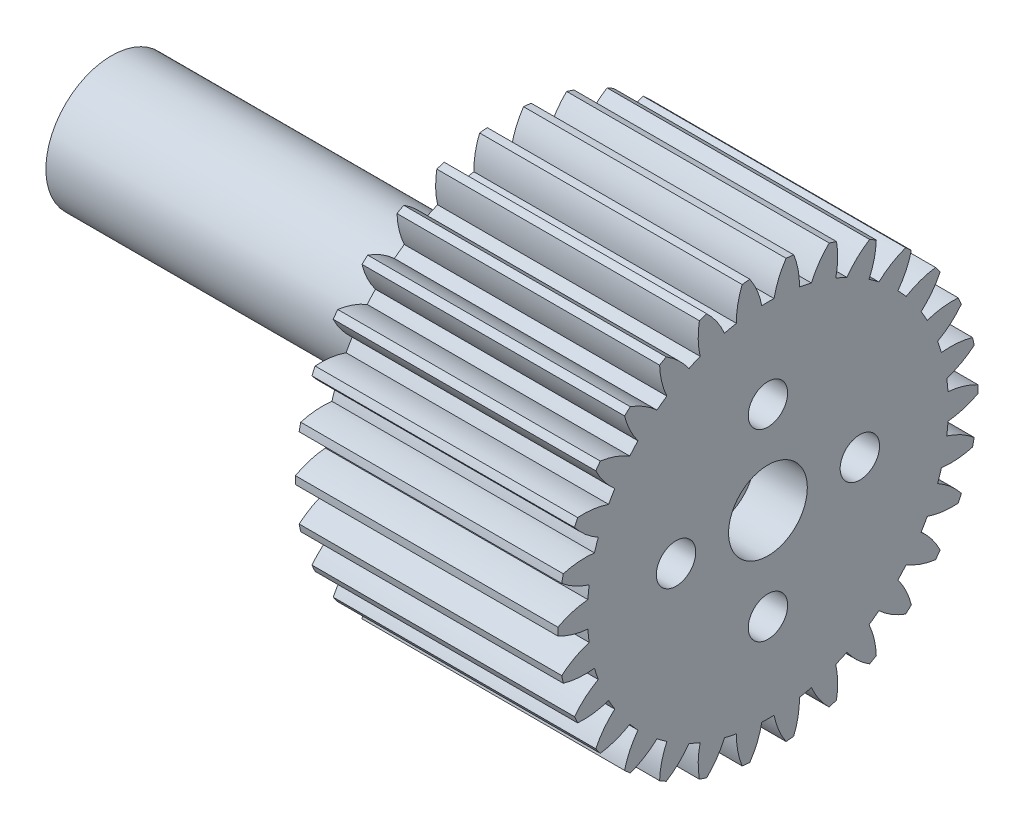
from build123d import *

# Parameters (mm, degrees)
BASPROSKE_W            = 20
BASPROSKE_H            = 16
TOOTHCUT_DEPTH         = 31.199337741
TEETHCUTS_COUNT        = 30
TEETHCUTS_ANGLE        = 348
BORSKE_R               = 0.4
BORE_DEPTH             = 50.0000508
SKETCH_2_R             = 5
EXTRUDE_1_DEPTH        = 50
CUT_EXTRUDE_1_REACH    = 56.864
SKETCH_3_R             = 1.5
CUT_EXTRUDE_2_DEPTH    = 4
HOLE_WIZARD_M6_1_D     = 5
HOLE_WIZARD_M6_1_DEPTH = 15
HOLE_WIZARD_M6_1_TIP   = 1.502151548


with BuildPart() as part:
    # BasProSke → Base-Revolve (revolve)
    with BuildSketch(Plane(origin=(0, 0, 0), x_dir=(1, 0, 0), z_dir=(0, 1, 0)), mode=Mode.PRIVATE) as base_revolve_sk:
        with Locations((10, 8)):
            Rectangle(BASPROSKE_W, BASPROSKE_H)
    revolve(base_revolve_sk.sketch.rotate(Axis((-10, 0, 0), (1, 0, 0)), 180), axis=Axis((-10, 0, 0), (1, 0, 0)))

    # TooCutSke → ToothCut (cut, through all)
    with BuildSketch(Plane(origin=(0, 0, 0), x_dir=(0, 0, -1), z_dir=(1, 0, 0))):
        with BuildLine():
            ThreePointArc((0.466400716, 13.741086979), (0, 13.749), (-0.466400716, 13.741086979))
            ThreePointArc((-0.466400716, 13.741086979), (-0.819142092, 14.899954875), (-1.3974676, 15.964351834))
            ThreePointArc((-1.3974676, 15.964351834), (0, 16.0254), (1.3974676, 15.964351834))
            ThreePointArc((1.3974676, 15.964351834), (0.819142092, 14.899954875), (0.466400716, 13.741086979))
        make_face()
    toothcut = extrude(amount=TOOTHCUT_DEPTH, mode=Mode.SUBTRACT)

    # TeethCuts: ToothCut ×30 about axis
    teethcuts_axis = Axis((-10, 0, 0), (1, 0, 0))
    for i in range(1, TEETHCUTS_COUNT):
        add(toothcut.rotate(teethcuts_axis, i * TEETHCUTS_ANGLE / (TEETHCUTS_COUNT - 1)), mode=Mode.SUBTRACT)

    # BorSke → Bore (cut, symmetric)
    with BuildSketch(Plane(origin=(0, 0, 0), x_dir=(0, 0, -1), z_dir=(1, 0, 0))):
        with Locations(Location((0, 0, 0), (0, 0, 180))):
            Circle(BORSKE_R)
    extrude(amount=BORE_DEPTH, both=True, mode=Mode.SUBTRACT)

    # 草图2 → 凸台-拉伸1 (add)
    with BuildSketch(Plane(origin=(20, 0, 0), x_dir=(0, 0, -1), z_dir=(1, 0, 0))):
        Circle(SKETCH_2_R)
    extrude(amount=-EXTRUDE_1_DEPTH)

    # 草图3 → 切除-拉伸1 (cut, up to next)
    with BuildSketch(Plane(origin=(20, 0, 0), x_dir=(0, 0, -1), z_dir=(1, 0, 0)), mode=Mode.PRIVATE) as cut_extrude_1_sk1:
        with Locations((0, 7)):
            Circle(SKETCH_3_R)
    cut_extrude_1_tool1 = extrude(cut_extrude_1_sk1.sketch, amount=-CUT_EXTRUDE_1_REACH, mode=Mode.PRIVATE) & part.part
    # 草图3 → 切除-拉伸1 (cut, up to next)
    with BuildSketch(Plane(origin=(20, 0, 0), x_dir=(0, 0, -1), z_dir=(1, 0, 0)), mode=Mode.PRIVATE) as cut_extrude_1_sk2:
        with Locations((7, 0)):
            Circle(SKETCH_3_R)
    cut_extrude_1_tool2 = extrude(cut_extrude_1_sk2.sketch, amount=-CUT_EXTRUDE_1_REACH, mode=Mode.PRIVATE) & part.part
    # 草图3 → 切除-拉伸1 (cut, up to next)
    with BuildSketch(Plane(origin=(20, 0, 0), x_dir=(0, 0, -1), z_dir=(1, 0, 0)), mode=Mode.PRIVATE) as cut_extrude_1_sk3:
        with Locations((0, -7)):
            Circle(SKETCH_3_R)
    cut_extrude_1_tool3 = extrude(cut_extrude_1_sk3.sketch, amount=-CUT_EXTRUDE_1_REACH, mode=Mode.PRIVATE) & part.part
    # 草图3 → 切除-拉伸1 (cut, up to next)
    with BuildSketch(Plane(origin=(20, 0, 0), x_dir=(0, 0, -1), z_dir=(1, 0, 0)), mode=Mode.PRIVATE) as cut_extrude_1_sk4:
        with Locations((-7, 0)):
            Circle(SKETCH_3_R)
    cut_extrude_1_tool4 = extrude(cut_extrude_1_sk4.sketch, amount=-CUT_EXTRUDE_1_REACH, mode=Mode.PRIVATE) & part.part
    add(cut_extrude_1_tool1.solids().sort_by_distance((20, 7, 0))[0], mode=Mode.SUBTRACT)
    add(cut_extrude_1_tool2.solids().sort_by_distance((20, 0, -7))[0], mode=Mode.SUBTRACT)
    add(cut_extrude_1_tool3.solids().sort_by_distance((20, -7, 0))[0], mode=Mode.SUBTRACT)
    add(cut_extrude_1_tool4.solids().sort_by_distance((20, 0, 7))[0], mode=Mode.SUBTRACT)

    # 草图1 → 切除-拉伸2 (cut)
    with BuildSketch(Plane(origin=(20, 0, 0), x_dir=(0, 0, -1), z_dir=(1, 0, 0))):
        with BuildLine():
            Line((-3, 0), (0, 0))
            Line((0, 0), (0, 3))
            ThreePointArc((0, 3), (-2.121320344, 2.121320344), (-3, 0))
        make_face()
        with BuildLine():
            Line((0, 3), (0, 0))
            Line((0, 0), (3, 0))
            ThreePointArc((3, 0), (2.121320344, 2.121320344), (0, 3))
        make_face()
        with BuildLine():
            Line((0, -3), (0, 0))
            Line((0, 0), (-3, 0))
            ThreePointArc((-3, 0), (-2.121320344, -2.121320344), (0, -3))
        make_face()
        with BuildLine():
            Line((3, 0), (0, 0))
            Line((0, 0), (0, -3))
            ThreePointArc((0, -3), (2.121320344, -2.121320344), (3, 0))
        make_face()
    extrude(amount=-CUT_EXTRUDE_2_DEPTH, mode=Mode.SUBTRACT)

    # M6 螺纹孔1
    with Locations(Plane.ZY.offset(30)):
        with Locations((0, 0)):
            Hole(HOLE_WIZARD_M6_1_D / 2, depth=HOLE_WIZARD_M6_1_DEPTH)
            with Locations((0, 0, -(HOLE_WIZARD_M6_1_DEPTH + HOLE_WIZARD_M6_1_TIP / 2))):  # 118° drill point
                Cone(0, HOLE_WIZARD_M6_1_D / 2, HOLE_WIZARD_M6_1_TIP, mode=Mode.SUBTRACT)


solid = part.part
